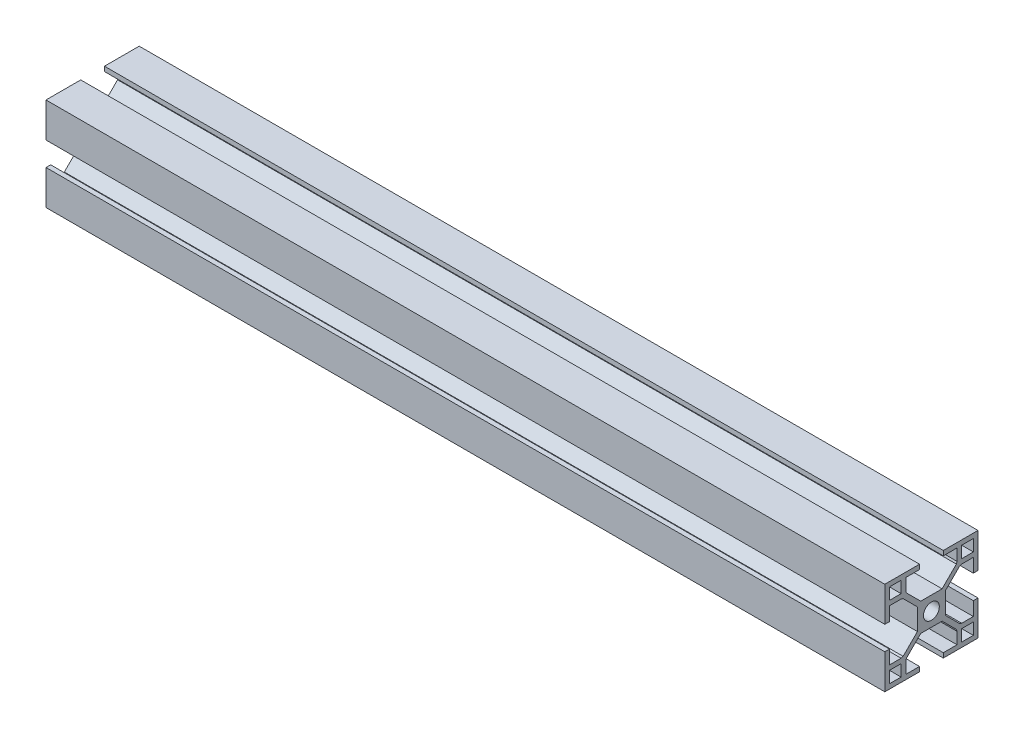
from build123d import *

# Parameters (mm, degrees)
SKETCH_1_R      = 3.4
SKETCH_1_W      = 5
SKETCH_1_H      = 5
EXTRUDE_1_DEPTH = 360


with BuildPart() as part:
    # 草图1 → 凸台-拉伸1 (new body)
    with BuildSketch(Plane(origin=(0, 0, 0), x_dir=(0, 0, -1), z_dir=(1, 0, 0))):
        Polygon((0, 6), (4.585786438, 6), (10.718811909, 12.133025471), (11, 13), (11, 18), (5.1, 18), (5.1, 20), (20, 20), (20, 5.1), (18, 5.1), (18, 11), (13, 11), (12.133025471, 10.718811909), (6, 4.585786438), (6, 0), (6, -4.585786438), (12.133025471, -10.718811909), (13, -11), (18, -11), (18, -5.1), (20, -5.1), (20, -20), (5.1, -20), (5.1, -18), (11, -18), (11, -13), (10.718811909, -12.133025471), (4.585786438, -6), (0, -6), (-4.585786438, -6), (-10.718811909, -12.133025471), (-11, -13), (-11, -18), (-5.1, -18), (-5.1, -20), (-20, -20), (-20, -5.1), (-18, -5.1), (-18, -11), (-13, -11), (-12.133025471, -10.718811909), (-6, -4.585786438), (-6, 0), (-6, 4.585786438), (-12.133025471, 10.718811909), (-13, 11), (-18, 11), (-18, 5.1), (-20, 5.1), (-20, 20), (-5.1, 20), (-5.1, 18), (-11, 18), (-11, 13), (-10.718811909, 12.133025471), (-4.585786438, 6), align=None)
        with Locations(Location((0, 0, 0), (0, 0, 180))):
            Circle(SKETCH_1_R, mode=Mode.SUBTRACT)
        with Locations((15.5, -15.5)):
            Rectangle(SKETCH_1_W, SKETCH_1_H, mode=Mode.SUBTRACT)
        with Locations((15.5, 15.5)):
            Rectangle(SKETCH_1_W, SKETCH_1_H, mode=Mode.SUBTRACT)
        with Locations((-15.5, -15.5)):
            Rectangle(SKETCH_1_W, SKETCH_1_H, mode=Mode.SUBTRACT)
        with Locations((-15.5, 15.5)):
            Rectangle(SKETCH_1_W, SKETCH_1_H, mode=Mode.SUBTRACT)
    extrude(amount=EXTRUDE_1_DEPTH)


solid = part.part
